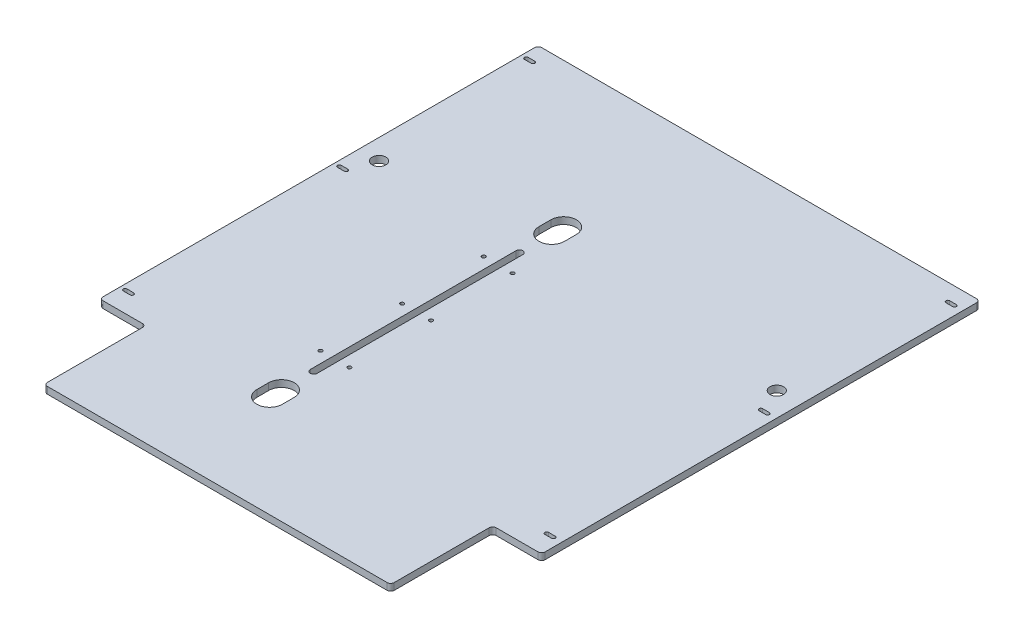
from build123d import *

# Parameters (mm, degrees)
BOSS_EXTRUDE1_DEPTH = 12.7
FILLET1_R           = 6.604
FILLET2_R           = 6.604
SKETCH2_R           = 12.7
CUT_EXTRUDE1_DEPTH  = 1173.069644902
CUT_EXTRUDE3_DEPTH  = 1173.069644902
CUT_EXTRUDE4_DEPTH  = 1173.069644902
SKETCH6_R           = 3.3782
CUT_EXTRUDE5_DEPTH  = 1173.069644902
CUT_EXTRUDE6_DEPTH  = 1173.069644902


with BuildPart() as part:
    # Sketch1 → Boss-Extrude1 (new body)
    with BuildSketch(Plane(origin=(0, 0, 0), x_dir=(1, 0, 0), z_dir=(0, 1, 0))):
        Polygon((0, 0), (96.04375, 0), (96.04375, -190.5), (743.74375, -190.5), (743.74375, 0), (838.2, 0), (838.2, 819.15), (0, 819.15), align=None)
        with BuildLine():
            Line((19.05, 41.4782), (31.75, 41.4782))
            ThreePointArc((31.75, 41.4782), (35.1282, 38.1), (31.75, 34.7218))
            Line((31.75, 34.7218), (19.05, 34.7218))
            ThreePointArc((19.05, 34.7218), (15.6718, 38.1), (19.05, 41.4782))
        make_face(mode=Mode.SUBTRACT)
        with BuildLine():
            Line((19.05, 441.5282), (31.75, 441.5282))
            ThreePointArc((31.75, 441.5282), (35.1282, 438.15), (31.75, 434.7718))
            Line((31.75, 434.7718), (19.05, 434.7718))
            ThreePointArc((19.05, 434.7718), (15.6718, 438.15), (19.05, 441.5282))
        make_face(mode=Mode.SUBTRACT)
        with BuildLine():
            Line((31.75, 784.0218), (19.05, 784.0218))
            ThreePointArc((19.05, 784.0218), (15.6718, 787.4), (19.05, 790.7782))
            Line((19.05, 790.7782), (31.75, 790.7782))
            ThreePointArc((31.75, 790.7782), (35.1282, 787.4), (31.75, 784.0218))
        make_face(mode=Mode.SUBTRACT)
        with BuildLine():
            Line((806.45, 784.0218), (819.15, 784.0218))
            ThreePointArc((819.15, 784.0218), (822.5282, 787.4), (819.15, 790.7782))
            Line((819.15, 790.7782), (806.45, 790.7782))
            ThreePointArc((806.45, 790.7782), (803.0718, 787.4), (806.45, 784.0218))
        make_face(mode=Mode.SUBTRACT)
        with BuildLine():
            Line((819.15, 441.5282), (806.45, 441.5282))
            ThreePointArc((806.45, 441.5282), (803.0718, 438.15), (806.45, 434.7718))
            Line((806.45, 434.7718), (819.15, 434.7718))
            ThreePointArc((819.15, 434.7718), (822.5282, 438.15), (819.15, 441.5282))
        make_face(mode=Mode.SUBTRACT)
        with BuildLine():
            Line((819.15, 41.4782), (806.45, 41.4782))
            ThreePointArc((806.45, 41.4782), (803.0718, 38.1), (806.45, 34.7218))
            Line((806.45, 34.7218), (819.15, 34.7218))
            ThreePointArc((819.15, 34.7218), (822.5282, 38.1), (819.15, 41.4782))
        make_face(mode=Mode.SUBTRACT)
    extrude(amount=BOSS_EXTRUDE1_DEPTH)

    # Fillet1
    fillet1_edges = [part.edges().sort_by_distance(p)[0] for p in [
        (743.74375, 6.35, 0),
        (96.04375, 6.35, 0),
    ]]
    fillet(fillet1_edges, radius=FILLET1_R)

    # Fillet2
    fillet2_edges = [part.edges().sort_by_distance(p)[0] for p in [
        (0, 6.35, -819.15),
        (838.2, 6.35, -819.15),
        (838.2, 6.35, 0),
        (743.74375, 6.35, 190.5),
        (96.04375, 6.35, 190.5),
        (0, 6.35, 0),
    ]]
    fillet(fillet2_edges, radius=FILLET2_R)

    # Sketch2 → Cut-Extrude1 (cut, through all)
    with BuildSketch(Plane(origin=(0, 12.7, 0), x_dir=(1, 0, 0), z_dir=(0, 1, 0))):
        with Locations(Location((47.625, 483.87, 0), (0, 0, 270))):
            Circle(SKETCH2_R)
        with Locations(Location((790.575, 483.87, 0), (0, 0, 270))):
            Circle(SKETCH2_R)
    extrude(amount=-CUT_EXTRUDE1_DEPTH, mode=Mode.SUBTRACT)

    # Sketch4 → Cut-Extrude3 (cut, through all)
    with BuildSketch(Plane.XZ):
        with BuildLine():
            Line((350.8375, -527.05), (350.8375, -549.275))
            ThreePointArc((350.8375, -549.275), (327.025, -573.0875), (303.2125, -549.275))
            Line((303.2125, -549.275), (303.2125, -527.05))
            ThreePointArc((303.2125, -527.05), (327.025, -503.2375), (350.8375, -527.05))
        make_face()
        with BuildLine():
            Line((350.8375, 0), (350.8375, -22.225))
            ThreePointArc((350.8375, -22.225), (327.025, -46.0375), (303.2125, -22.225))
            Line((303.2125, -22.225), (303.2125, 0))
            ThreePointArc((303.2125, 0), (327.025, 23.8125), (350.8375, 0))
        make_face()
    extrude(amount=-CUT_EXTRUDE3_DEPTH, mode=Mode.SUBTRACT)

    # Sketch5 → Cut-Extrude4 (cut, through all)
    with BuildSketch(Plane.XZ):
        with BuildLine():
            Line((320.675, -466.725), (320.675, -82.55))
            ThreePointArc((320.675, -82.55), (327.025, -76.2), (333.375, -82.55))
            Line((333.375, -82.55), (333.375, -466.725))
            ThreePointArc((333.375, -466.725), (327.025, -473.075), (320.675, -466.725))
        make_face()
    extrude(amount=-CUT_EXTRUDE4_DEPTH, mode=Mode.SUBTRACT)

    # Sketch6 → Cut-Extrude5 (cut, through all)
    with BuildSketch(Plane.XZ):
        with Locations(Location((354.0125, -274.6375, 0), (0, 0, 270))):
            Circle(SKETCH6_R)
        with Locations(Location((354.0125, -427.0375, 0), (0, 0, 270))):
            Circle(SKETCH6_R)
        with Locations(Location((354.0125, -122.2375, 0), (0, 0, 90))):
            Circle(SKETCH6_R)
        with Locations(Location((300.0375, -427.0375, 0), (0, 0, 90))):
            Circle(SKETCH6_R)
        with Locations(Location((300.0375, -274.6375, 0), (0, 0, 90))):
            Circle(SKETCH6_R)
        with Locations(Location((300.0375, -122.2375, 0), (0, 0, 270))):
            Circle(SKETCH6_R)
    extrude(amount=-CUT_EXTRUDE5_DEPTH, mode=Mode.SUBTRACT)

    # Sketch7 → Cut-Extrude6 (cut, through all)
    with BuildSketch(Plane.XZ):
        with BuildLine():
            ThreePointArc((9.525, -812.546), (11.459266817, -817.215733183), (16.129, -819.15))
            Line((16.129, -819.15), (6.604, -819.15))
            ThreePointArc((6.604, -819.15), (1.934266817, -817.215733183), (0, -812.546))
            Line((0, -812.546), (0, -6.604))
            ThreePointArc((0, -6.604), (1.934266817, -1.934266817), (6.604, 0))
            Line((6.604, 0), (16.129, 0))
            ThreePointArc((16.129, 0), (11.459266817, -1.934266817), (9.525, -6.604))
            Line((9.525, -6.604), (9.525, -812.546))
        make_face()
        with BuildLine():
            ThreePointArc((835.025, -6.604), (833.090733183, -1.934266817), (828.421, 0))
            Line((828.421, 0), (831.596, 0))
            ThreePointArc((831.596, 0), (836.265733183, -1.934266817), (838.2, -6.604))
            Line((838.2, -6.604), (838.2, -812.546))
            ThreePointArc((838.2, -812.546), (836.265733183, -817.215733183), (831.596, -819.15))
            Line((831.596, -819.15), (828.421, -819.15))
            ThreePointArc((828.421, -819.15), (833.090733183, -817.215733183), (835.025, -812.546))
            Line((835.025, -812.546), (835.025, -6.604))
        make_face()
    extrude(amount=-CUT_EXTRUDE6_DEPTH, mode=Mode.SUBTRACT)


solid = part.part
